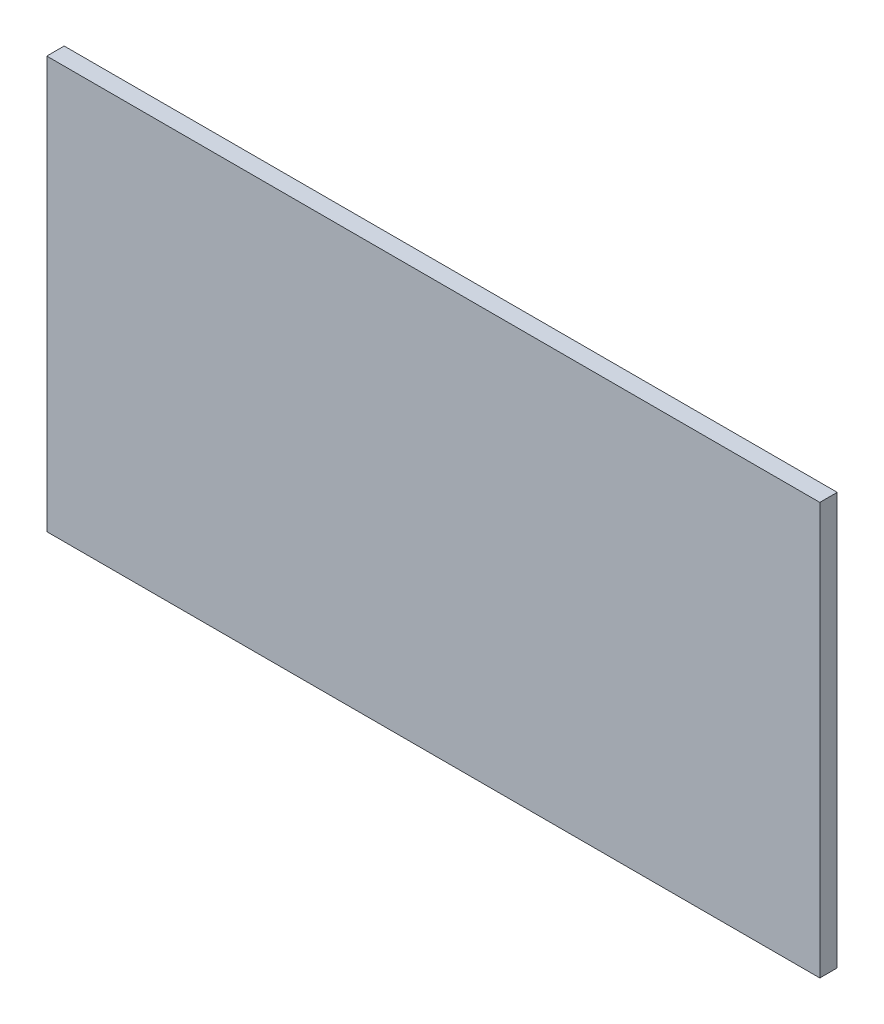
from build123d import *

# Parameters (mm, degrees)
CROQUIS1_W              = 44.39506519
CROQUIS1_H              = 23.65432296
SALIENTE_EXTRUIR1_DEPTH = 1


with BuildPart() as part:
    # Croquis1 → Saliente-Extruir1 (new body)
    with BuildSketch(Plane.XY):
        with Locations((-35.698756448, 4.555917957)):
            Rectangle(CROQUIS1_W, CROQUIS1_H)
    extrude(amount=SALIENTE_EXTRUIR1_DEPTH)


solid = part.part
